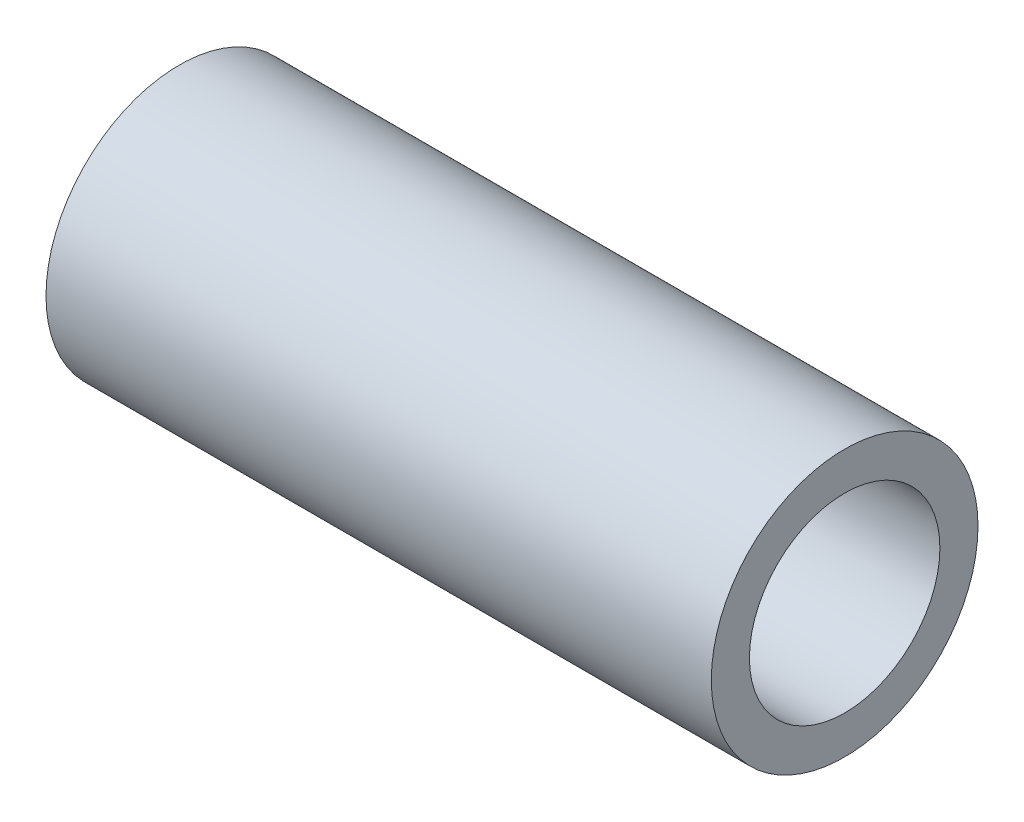
from build123d import *

# Parameters (mm, degrees)
SKETCH1_R           = 3.5
SKETCH1_R_2         = 2.5
BOSS_EXTRUDE1_DEPTH = 17.4625


with BuildPart() as part:
    # Sketch1 → Boss-Extrude1 (new body)
    with BuildSketch(Plane(origin=(0, 0, 0), x_dir=(0, 0, -1), z_dir=(1, 0, 0))):
        Circle(SKETCH1_R)
        Circle(SKETCH1_R_2, mode=Mode.SUBTRACT)
    extrude(amount=BOSS_EXTRUDE1_DEPTH)


solid = part.part
